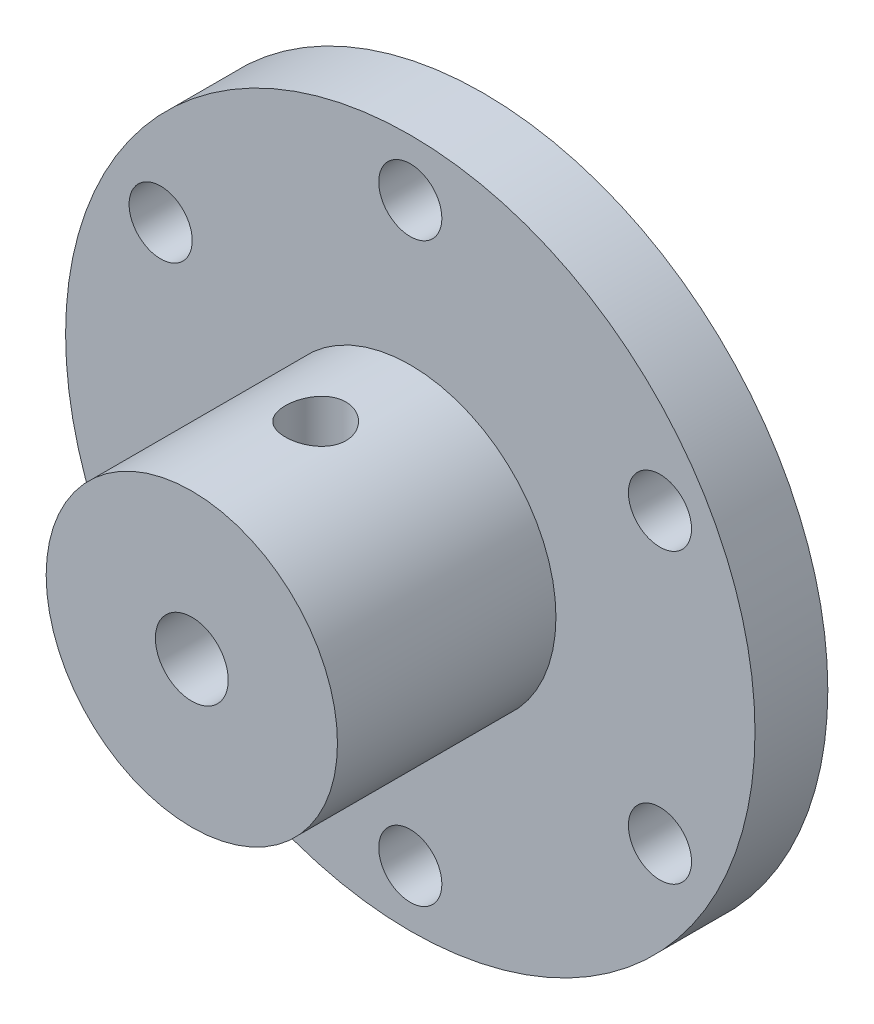
from build123d import *

# Parameters (mm, degrees)
SKETCH1_R               = 28.4
SKETCH1_R_2             = 3
SKETCH1_R_3             = 2.6
BOSS_EXTRUDE1_DEPTH     = 6
SKETCH3_R               = 12
BOSS_EXTRUDE2_DEPTH     = 24
SKETCH1_3_R             = 3
CUT_EXTRUDE1_DEPTH      = 24
CUT_EXTRUDE2_REACH      = 48.788
CUT_EXTRUDE2_END_RADIUS = 12
SKETCH4_R               = 2.5


with BuildPart() as part:
    # Sketch1 → Boss-Extrude1 (new body)
    # profile 1 of 2: a face of its own
    with BuildSketch(Plane.XY):
        Circle(SKETCH1_R)
        Circle(SKETCH1_R_2, mode=Mode.SUBTRACT)
        with Locations((-20.56810334, 11.875)):
            Circle(SKETCH1_R_3, mode=Mode.SUBTRACT)
        with Locations((-20.56810334, -11.875)):
            Circle(SKETCH1_R_3, mode=Mode.SUBTRACT)
        with Locations((0, -23.75)):
            Circle(SKETCH1_R_3, mode=Mode.SUBTRACT)
        with Locations((20.56810334, -11.875)):
            Circle(SKETCH1_R_3, mode=Mode.SUBTRACT)
        with Locations((20.56810334, 11.875)):
            Circle(SKETCH1_R_3, mode=Mode.SUBTRACT)
        with Locations((0, 23.75)):
            Circle(SKETCH1_R_3, mode=Mode.SUBTRACT)
    # profile 2 of 2: a face of its own
    with BuildSketch(Plane.XY):
        Circle(SKETCH1_R_2)
    extrude(amount=BOSS_EXTRUDE1_DEPTH)

    # Sketch3 → Boss-Extrude2 (add)
    with BuildSketch(Plane(origin=(0, 0, 0), x_dir=(-1, 0, 0), z_dir=(0, 0, -1))):
        Circle(SKETCH3_R)
    extrude(amount=-BOSS_EXTRUDE2_DEPTH)

    # Sketch1<3> → Cut-Extrude1 (cut)
    with BuildSketch(Plane.XY):
        with Locations(Location((0, 0, 0), (0, 0, 180))):
            Circle(SKETCH1_3_R)
    extrude(amount=CUT_EXTRUDE1_DEPTH, mode=Mode.SUBTRACT)

    # Cut-Extrude2: up to this cylinder (the profile starts inside it)
    cut_extrude2_end = Plane(origin=(0, 0, 13.8), z_dir=(0, 0, -1)) * Cylinder(CUT_EXTRUDE2_END_RADIUS, 122.576, mode=Mode.PRIVATE)
    # Sketch4 → Cut-Extrude2 (cut, up to the surface)
    with BuildSketch(Plane(origin=(0, 0, 0), x_dir=(1, 0, 0), z_dir=(0, 1, 0)), mode=Mode.PRIVATE) as cut_extrude2_sk1:
        with Locations(Location((0, -13.8, 0), (0, 0, 90))):
            Circle(SKETCH4_R)
    cut_extrude2_tool1 = extrude(cut_extrude2_sk1.sketch, amount=CUT_EXTRUDE2_REACH, mode=Mode.PRIVATE) & cut_extrude2_end
    add(cut_extrude2_tool1.solids().sort_by_distance((0, 0, 13.8))[0], mode=Mode.SUBTRACT)


solid = part.part
